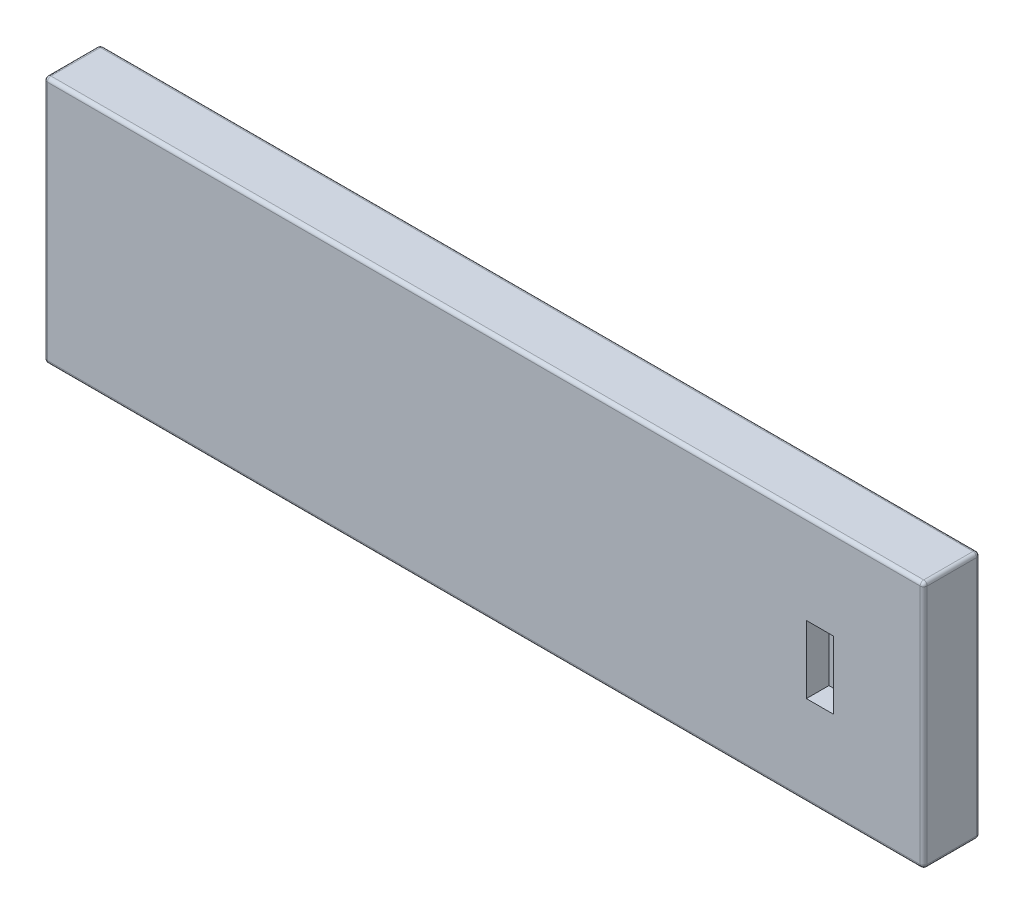
from build123d import *

# Parameters (mm, degrees)
SKETCH1_W           = 123.825
SKETCH1_H           = 34.925
BOSS_EXTRUDE1_DEPTH = 3.96875
SKETCH2_W           = 3.81
SKETCH2_H           = 9.525
CUT_EXTRUDE1_DEPTH  = 3.175
FILLET2_R           = 0.5
FILLET3_R           = 0.5
SKETCH3_W           = 0.205128206
SKETCH3_H           = 0.769230769
SKETCH3_W_2         = 2.58974359
SKETCH3_H_2         = 0.179487179
SKETCH3_W_3         = 2
SKETCH3_H_3         = 0.17948718
CUT_EXTRUDE2_DEPTH  = 1


with BuildPart() as part:
    # Sketch1 → Boss-Extrude1 (new, symmetric)
    with BuildSketch(Plane.XY):
        Rectangle(SKETCH1_W, SKETCH1_H)
    extrude(amount=BOSS_EXTRUDE1_DEPTH, both=True)

    # Sketch2 → Cut-Extrude1 (cut)
    with BuildSketch(Plane.XY.offset(3.96875)):
        with Locations((47.3075, 0)):
            Rectangle(SKETCH2_W, SKETCH2_H)
    extrude(amount=-CUT_EXTRUDE1_DEPTH, mode=Mode.SUBTRACT)

    # Fillet2
    fillet2_edges = [part.edges().sort_by_distance(p)[0] for p in [
        (-61.9125, 0, 3.96875),
        (0, -17.4625, 3.96875),
        (61.9125, 0, 3.96875),
        (61.9125, -17.4625, 0),
        (-61.9125, -17.4625, 0),
        (-61.9125, 17.4625, 0),
        (61.9125, 17.4625, 0),
        (0, 17.4625, 3.96875),
    ]]
    fillet(fillet2_edges, radius=FILLET2_R)

    # Fillet3
    fillet3_edges = [part.edges().sort_by_distance(p)[0] for p in [
        (61.9125, 0, -3.96875),
        (0, -17.4625, -3.96875),
        (-61.9125, 0, -3.96875),
        (0, 17.4625, -3.96875),
        (-61.766053391, 17.316053391, -3.96875),
        (-61.766053391, -17.316053391, -3.96875),
        (61.766053391, 17.316053391, -3.96875),
        (61.766053391, -17.316053391, -3.96875),
    ]]
    fillet(fillet3_edges, radius=FILLET3_R)

    # Sketch3 → Cut-Extrude2 (cut)
    # profile 1 of 12: a face of its own
    with BuildSketch(Plane.ZY.offset(61.9125)):
        Polygon((1.024712068, 9.333333333), (1.024712068, 8.205128205), (0.819583863, 8.205128205), (0.819583863, 9.153846154), (0.204199247, 9.153846154), (0.204199247, 8.205128205), (-0.000928958, 8.205128205), (-0.000928958, 9.153846154), (-0.770159727, 9.153846154), (-0.770159727, 8.205128205), (-0.975287932, 8.205128205), (-0.975287932, 9.333333333), align=None)
    # profile 2 of 12: a face of its own
    with BuildSketch(Plane.ZY.offset(61.9125)):
        Polygon((1.075994119, 6.933894231), (1.075994119, 6.897435897), (-0.308621266, 6.897435897), (-0.308621266, 6.666666667), (-0.513749471, 6.666666667), (-0.513749471, 6.897435897), (-0.975287932, 6.897435897), (-0.975287932, 7.076923077), (-0.513749471, 7.076923077), (-0.513749471, 8.025641026), align=None)
        Polygon((-0.308621266, 7.076923077), (0.559968478, 7.076923077), (-0.308621266, 7.673076923), align=None, mode=Mode.SUBTRACT)
    # profile 3 of 12: a face of its own
    with BuildSketch(Plane.ZY.offset(61.9125)):
        with Locations((-0.206057163, 5.333333334)):
            Rectangle(SKETCH3_W, SKETCH3_H)
    # profile 4 of 12: a face of its own
    with BuildSketch(Plane.ZY.offset(61.9125)):
        with BuildLine():
            Line((1.024712068, 2.769230769), (0.819583863, 2.769230769))
            Line((0.819583863, 2.769230769), (0.819583863, 3.449519231))
            Line((0.819583863, 3.449519231), (0.293542196, 3.557291667))
            add(Edge.make_bspline(
                [(0.293542196, 3.557291667), (0.299388066, 3.536116881), (0.310713513, 3.495094084), (0.323288239, 3.434545592), (0.330868493, 3.377064333), (0.331903528, 3.339764121), (0.332404375, 3.321714744)],
                knots=[0, 0, 0, 0, 1.100273476, 2.13160584, 3.095893838, 4, 4, 4, 4], degree=3))
            add(Edge.make_bspline(
                [(0.332404375, 3.321714744), (0.331920857, 3.299381255), (0.330970139, 3.255468037), (0.321845166, 3.191216115), (0.307472971, 3.12988701), (0.287427799, 3.071585506), (0.26162993, 3.016186028), (0.229821698, 2.963997951), (0.192223116, 2.914725508), (0.149196947, 2.869020059), (0.101784968, 2.827620389), (0.050974137, 2.791076771), (-0.003281763, 2.760684274), (-0.060742816, 2.735679911), (-0.12131261, 2.715841364), (-0.18543948, 2.702601029), (-0.25255436, 2.693794419), (-0.298442454, 2.69280979), (-0.321842419, 2.692307692)],
                knots=[0, 0, 0, 0, 1.052772836, 2.070014431, 3.053871312, 4.019926262, 4.972333346, 5.930471369, 6.896690565, 7.89035727, 8.885779078, 9.861050232, 10.836829716, 11.812751485, 12.812646763, 13.836748493, 14.896881366, 16, 16, 16, 16], degree=3))
            add(Edge.make_bspline(
                [(-0.321842419, 2.692307692), (-0.338140852, 2.692687684), (-0.370517459, 2.693442533), (-0.418599546, 2.697282476), (-0.465665188, 2.704671522), (-0.511713681, 2.714606238), (-0.55668346, 2.727449664), (-0.600558169, 2.743166409), (-0.643472907, 2.761692576), (-0.685430482, 2.782609059), (-0.725137411, 2.806805552), (-0.763206629, 2.832293734), (-0.798237109, 2.860527624), (-0.831507697, 2.890140277), (-0.861711805, 2.922315781), (-0.890141997, 2.956055461), (-0.915563323, 2.992151102), (-0.938945205, 3.029956458), (-0.959880434, 3.069447689), (-0.977344154, 3.111025229), (-0.992651256, 3.153776342), (-1.005099072, 3.198082064), (-1.014756779, 3.243856561), (-1.021333546, 3.291257461), (-1.026118716, 3.340046915), (-1.026418535, 3.373118283), (-1.026569984, 3.389823718)],
                knots=[0, 0, 0, 0, 1.05623316, 2.098192244, 3.122504159, 4.140841222, 5.148757784, 6.150489607, 7.158294732, 8.176043417, 9.185147859, 10.169157858, 11.142149047, 12.097904048, 13.0527185, 13.998867679, 14.954465986, 15.910220987, 16.877849176, 17.847023716, 18.829548819, 19.818454515, 20.826519638, 21.858115382, 22.918063636, 24, 24, 24, 24], degree=3))
            add(Edge.make_bspline(
                [(-1.026569984, 3.389823718), (-1.026175184, 3.409751797), (-1.025398464, 3.448957938), (-1.017274108, 3.50639861), (-1.005635784, 3.561662829), (-0.988135903, 3.614313228), (-0.966176101, 3.664794019), (-0.938598427, 3.712433206), (-0.906910425, 3.75816716), (-0.870018751, 3.800752886), (-0.829317633, 3.84019738), (-0.785622519, 3.876048998), (-0.73875967, 3.907490653), (-0.689128047, 3.934650655), (-0.636642251, 3.957784281), (-0.581145223, 3.975966509), (-0.522916148, 3.990639242), (-0.482828497, 3.996846996), (-0.462467419, 4)],
                knots=[0, 0, 0, 0, 1.046825758, 2.059506013, 3.044032586, 4.011925612, 4.970610144, 5.93275819, 6.900651216, 7.891265644, 8.889116719, 9.876966323, 10.858259055, 11.851035124, 12.847502422, 13.86866322, 14.9174643, 16, 16, 16, 16], degree=3))
            Line((-0.462467419, 4), (-0.462467419, 3.820512821))
            add(Edge.make_bspline(
                [(-0.462467419, 3.820512821), (-0.481541498, 3.816099281), (-0.518202935, 3.807616214), (-0.569682343, 3.78894737), (-0.615730166, 3.766261983), (-0.656389875, 3.738672926), (-0.692032442, 3.706428015), (-0.72406929, 3.6698973), (-0.752588855, 3.628560354), (-0.776514327, 3.582643529), (-0.796889133, 3.534172832), (-0.810463484, 3.483450331), (-0.820006341, 3.431847424), (-0.820961701, 3.396945555), (-0.821441778, 3.379407051)],
                knots=[0, 0, 0, 0, 1.136389429, 2.184203582, 3.172920998, 4.111012962, 5.028380909, 5.957351669, 6.927793475, 7.937618031, 8.960409703, 9.974842029, 10.982339866, 12, 12, 12, 12], degree=3))
            add(Edge.make_bspline(
                [(-0.821441778, 3.379407051), (-0.820972762, 3.36228794), (-0.820049266, 3.32858027), (-0.812941259, 3.278973764), (-0.801994076, 3.231080693), (-0.785611301, 3.185373632), (-0.765700034, 3.141052752), (-0.740148562, 3.099239169), (-0.710742837, 3.058723239), (-0.677053334, 3.020764306), (-0.639927794, 2.985998906), (-0.600226427, 2.955281123), (-0.557873943, 2.929694315), (-0.51360357, 2.908131967), (-0.466930109, 2.891758653), (-0.418072294, 2.880078093), (-0.366909448, 2.873219202), (-0.3320127, 2.87227567), (-0.31423024, 2.871794872)],
                knots=[0, 0, 0, 0, 1.027316725, 2.022795036, 3.002884548, 3.971462791, 4.93288096, 5.914575861, 6.907176829, 7.935150275, 8.956128384, 9.956726525, 10.942570165, 11.921478529, 12.907843606, 13.90538589, 14.932640048, 16, 16, 16, 16], degree=3))
            add(Edge.make_bspline(
                [(-0.31423024, 2.871794872), (-0.298177286, 2.87211054), (-0.266737907, 2.872728771), (-0.220944097, 2.879598827), (-0.177299929, 2.889222709), (-0.136195699, 2.903998953), (-0.097029495, 2.922256256), (-0.060639617, 2.945419161), (-0.026091146, 2.971896748), (0.005212401, 3.002909326), (0.034299122, 3.036727224), (0.059058406, 3.07413547), (0.079897295, 3.114280811), (0.097878355, 3.156698605), (0.110793249, 3.202392587), (0.120489132, 3.250459304), (0.126097925, 3.301417403), (0.126876145, 3.336257799), (0.12727617, 3.354166667)],
                knots=[0, 0, 0, 0, 1.045726679, 2.048034203, 3.01323695, 3.95502507, 4.889743367, 5.8246644, 6.761650845, 7.722168973, 8.692072792, 9.66525385, 10.638902184, 11.638179751, 12.663148338, 13.728659964, 14.832472288, 16, 16, 16, 16], degree=3))
            add(Edge.make_bspline(
                [(0.12727617, 3.354166667), (0.12695567, 3.369803537), (0.126299556, 3.401814638), (0.121136074, 3.451031651), (0.113192554, 3.502526279), (0.101743406, 3.556498442), (0.087408285, 3.612800022), (0.069505517, 3.671524649), (0.048883785, 3.732673742), (0.032888867, 3.773831461), (0.024712068, 3.794871795)],
                knots=[0, 0, 0, 0, 0.824638674, 1.688163388, 2.607705698, 3.571998603, 4.597075385, 5.671199175, 6.809488238, 8, 8, 8, 8], degree=3))
            Line((0.024712068, 3.794871795), (1.024712068, 3.58974359))
            Line((1.024712068, 3.58974359), (1.024712068, 2.769230769))
        make_face()
    # profile 5 of 12: a face of its own
    with BuildSketch(Plane.ZY.offset(61.9125)):
        Polygon((1.024712068, 2.062099359), (1.024712068, 1.692307692), (-0.975287932, 1.692307692), (-0.975287932, 1.871794872), (0.819583863, 1.871794872), (0.819583863, 2.179487179), align=None)
    # profile 6 of 12: a face of its own
    with BuildSketch(Plane.ZY.offset(61.9125)):
        with BuildLine():
            add(Edge.make_bspline(
                [(0.023910786, 0.948717949), (0.055966436, 0.94853051), (0.118234998, 0.948166407), (0.208969079, 0.944115881), (0.294089245, 0.937387114), (0.373599567, 0.928165757), (0.44752058, 0.916944059), (0.515654712, 0.901963764), (0.578317395, 0.884927932), (0.635712681, 0.865183491), (0.688614811, 0.842905395), (0.737998577, 0.81865499), (0.783801283, 0.791483107), (0.826711008, 0.762896272), (0.866248859, 0.731849846), (0.902339961, 0.698671292), (0.935006106, 0.663031492), (0.964636077, 0.62563532), (0.990447559, 0.586246443), (1.01370542, 0.546079089), (1.032794569, 0.504424472), (1.048479723, 0.461662496), (1.061047839, 0.417917516), (1.069751236, 0.373008782), (1.075205926, 0.326925445), (1.075728895, 0.295822117), (1.075994119, 0.280048077)],
                knots=[0, 0, 0, 0, 1.646377244, 3.198111528, 4.663803227, 6.031090796, 7.308794487, 8.502186765, 9.612154809, 10.642545331, 11.617106989, 12.558866172, 13.465886467, 14.35053239, 15.20542558, 16.045215227, 16.865619885, 17.686225247, 18.492864914, 19.282407821, 20.068097601, 20.842842034, 21.620163247, 22.403093475, 23.190129512, 24, 24, 24, 24], degree=3))
            add(Edge.make_bspline(
                [(1.075994119, 0.280048077), (1.075715368, 0.264142089), (1.075161018, 0.232510084), (1.069833051, 0.185744155), (1.060992409, 0.140058623), (1.048466138, 0.095648258), (1.032925752, 0.052148266), (1.013447399, 0.00989889), (0.990773761, -0.0313623), (0.964131545, -0.070979607), (0.934427387, -0.109387958), (0.900848719, -0.145643937), (0.863734594, -0.179750843), (0.8234821, -0.212136732), (0.779319195, -0.241882788), (0.732013989, -0.270210463), (0.680739209, -0.295565912), (0.62635037, -0.319985727), (0.567342565, -0.341064005), (0.504048416, -0.360073288), (0.43572031, -0.375432699), (0.362716741, -0.388226568), (0.284769608, -0.398137938), (0.202045999, -0.40535659), (0.11449149, -0.409169782), (0.054629862, -0.409887897), (0.023910786, -0.41025641)],
                knots=[0, 0, 0, 0, 0.810914788, 1.612654377, 2.396697861, 3.181598691, 3.963628158, 4.749916497, 5.551656086, 6.361998678, 7.18212741, 8.025565596, 8.878627764, 9.750805457, 10.657531673, 11.591944965, 12.560506719, 13.57287815, 14.630710178, 15.753379473, 16.941251878, 18.199788006, 19.531962791, 20.947069417, 22.433333509, 24, 24, 24, 24], degree=3))
            add(Edge.make_bspline(
                [(0.023910786, -0.41025641), (-0.00667419, -0.409883616), (-0.066267768, -0.409157242), (-0.153429906, -0.405404339), (-0.235708951, -0.39797707), (-0.313333938, -0.38879071), (-0.385843982, -0.375704868), (-0.453928567, -0.360828571), (-0.517000132, -0.342338932), (-0.575696734, -0.321547951), (-0.629819103, -0.297658023), (-0.680650637, -0.272078478), (-0.727917243, -0.243924684), (-0.772079507, -0.21400123), (-0.812681094, -0.181890617), (-0.84982235, -0.147639288), (-0.883478778, -0.111221172), (-0.913588788, -0.072725984), (-0.939920869, -0.03248544), (-0.963457515, 0.008638024), (-0.982556043, 0.051465198), (-0.998681301, 0.095044282), (-1.011236389, 0.139786472), (-1.019832773, 0.185647883), (-1.025878455, 0.23247832), (-1.026338676, 0.264136586), (-1.026569984, 0.280048077)],
                knots=[0, 0, 0, 0, 1.56130642, 3.042141888, 4.451772327, 5.777565838, 7.030558081, 8.211376819, 9.333164717, 10.383253789, 11.387583522, 12.350962576, 13.286244149, 14.193812918, 15.072134482, 15.925989337, 16.770211267, 17.600669898, 18.417446232, 19.22325363, 20.01647746, 20.807971184, 21.593601364, 22.38506573, 23.188331689, 24, 24, 24, 24], degree=3))
            add(Edge.make_bspline(
                [(-1.026569984, 0.280048077), (-1.026302207, 0.295821476), (-1.025774205, 0.32692354), (-1.02035638, 0.373016134), (-1.011521733, 0.417854828), (-0.999524325, 0.461529259), (-0.984276332, 0.504128806), (-0.964881449, 0.545236166), (-0.942386402, 0.585394226), (-0.916794076, 0.624419742), (-0.887465937, 0.661568912), (-0.855029887, 0.697054578), (-0.818672363, 0.729980742), (-0.778975323, 0.760638058), (-0.736275596, 0.789730186), (-0.690152559, 0.816635804), (-0.640306097, 0.840838907), (-0.587111931, 0.863616275), (-0.529294818, 0.883694481), (-0.466297918, 0.901296177), (-0.397772747, 0.915969652), (-0.323922736, 0.927770137), (-0.244692612, 0.937498449), (-0.159942873, 0.944084019), (-0.069746641, 0.948169633), (-0.007878052, 0.948531841), (0.023910786, 0.948717949)],
                knots=[0, 0, 0, 0, 0.810940842, 1.599017053, 2.38298203, 3.159479784, 3.926441347, 4.70693857, 5.494146311, 6.292334103, 7.104379492, 7.925868426, 8.762126819, 9.623561095, 10.503686106, 11.41783325, 12.366995289, 13.351843594, 14.392337808, 15.512229747, 16.713911458, 17.994391108, 19.357476964, 20.818259213, 22.365182633, 24, 24, 24, 24], degree=3))
        make_face()
        with BuildLine():
            add(Edge.make_bspline(
                [(0.024712068, 0.769230769), (-0.002001474, 0.769162514), (-0.053847214, 0.769030043), (-0.12918622, 0.765569357), (-0.19945498, 0.760854939), (-0.264742714, 0.754774196), (-0.32482844, 0.745743946), (-0.380125386, 0.735625763), (-0.430341002, 0.723312628), (-0.475819579, 0.708743853), (-0.517333921, 0.69215074), (-0.555961128, 0.67403081), (-0.592169521, 0.654575658), (-0.625591343, 0.63276437), (-0.656559285, 0.609091672), (-0.684984352, 0.583518693), (-0.71074252, 0.556090407), (-0.741307083, 0.518120669), (-0.773265088, 0.468240401), (-0.800751412, 0.405070781), (-0.8181366, 0.340132846), (-0.82034133, 0.296044381), (-0.821441778, 0.274038462)],
                knots=[0, 0, 0, 0, 1.459116078, 2.831857795, 4.118796693, 5.306371758, 6.412361096, 7.436813035, 8.376339383, 9.234574298, 10.043323891, 10.816788787, 11.564361537, 12.286735248, 12.994408768, 13.691741332, 14.372975427, 15.047457468, 16.352811911, 17.594285292, 18.799233213, 20, 20, 20, 20], degree=3))
            add(Edge.make_bspline(
                [(-0.821441778, 0.274038462), (-0.820528761, 0.251891221), (-0.818704611, 0.207642464), (-0.801105332, 0.142994582), (-0.77455131, 0.080234427), (-0.743152735, 0.031050461), (-0.713250833, -0.006368135), (-0.687756748, -0.033177844), (-0.659210538, -0.057784728), (-0.62841094, -0.081123057), (-0.594769521, -0.102528243), (-0.558448049, -0.121992893), (-0.519345662, -0.139754806), (-0.492048668, -0.149874261), (-0.478092419, -0.155048077)],
                knots=[0, 0, 0, 0, 1.353760809, 2.704726607, 4.075137775, 5.516104923, 6.260822281, 7.007110065, 7.778089737, 8.566572457, 9.372053459, 10.217411131, 11.088608312, 12, 12, 12, 12], degree=3))
            add(Edge.make_bspline(
                [(-0.478092419, -0.155048077), (-0.460246854, -0.161077659), (-0.424012703, -0.173320295), (-0.367804902, -0.189098452), (-0.308831894, -0.201524394), (-0.247446113, -0.21270346), (-0.183194855, -0.220333778), (-0.116276922, -0.226475386), (-0.046641857, -0.230092921), (0.000669566, -0.23054135), (0.024712068, -0.230769231)],
                knots=[0, 0, 0, 0, 0.884706709, 1.796334032, 2.740027952, 3.714592787, 4.726048262, 5.777819803, 6.87074269, 8, 8, 8, 8], degree=3))
            add(Edge.make_bspline(
                [(0.024712068, -0.230769231), (0.048754053, -0.230517903), (0.095791132, -0.230026191), (0.164606422, -0.226795597), (0.230080332, -0.221604303), (0.292272257, -0.214577999), (0.351071503, -0.20493237), (0.406562212, -0.193348929), (0.458729422, -0.179768675), (0.50770767, -0.164191717), (0.553320913, -0.146636702), (0.595668462, -0.127243674), (0.634974817, -0.106548686), (0.671127155, -0.084066613), (0.704288659, -0.06006928), (0.733794128, -0.033922058), (0.760558113, -0.006662429), (0.791108152, 0.031518824), (0.822257693, 0.08150413), (0.850923841, 0.143701644), (0.867385723, 0.208427726), (0.869706687, 0.252183986), (0.870865914, 0.274038462)],
                knots=[0, 0, 0, 0, 1.313668642, 2.570134578, 3.763346207, 4.902004944, 5.98888779, 7.017888835, 7.998425394, 8.933058446, 9.82474457, 10.667209444, 11.476765193, 12.250262638, 12.991704352, 13.7104269, 14.401925311, 15.076585796, 16.378385137, 17.609787933, 18.806186071, 20, 20, 20, 20], degree=3))
            add(Edge.make_bspline(
                [(0.870865914, 0.274038462), (0.869706583, 0.296159729), (0.867385809, 0.340442563), (0.850967008, 0.405827324), (0.822524581, 0.468467899), (0.790906999, 0.518052178), (0.761098935, 0.556185259), (0.73517773, 0.583112537), (0.706666672, 0.608286739), (0.675829841, 0.631979159), (0.642391163, 0.65376945), (0.606188035, 0.673232564), (0.567557239, 0.691342093), (0.526052341, 0.707970831), (0.480505203, 0.72240459), (0.43054302, 0.735305709), (0.375194425, 0.745417753), (0.314940715, 0.75424195), (0.249572722, 0.760969901), (0.17914196, 0.765557255), (0.103672668, 0.769036305), (0.051559426, 0.76916465), (0.024712068, 0.769230769)],
                knots=[0, 0, 0, 0, 1.207964612, 2.418129846, 3.655795183, 4.951004962, 5.620895151, 6.296795572, 6.989224116, 7.696855977, 8.419187164, 9.166715907, 9.940135271, 10.748837255, 11.607021648, 12.548275234, 13.5654991, 14.678641405, 15.874140913, 17.15372626, 18.533675393, 20, 20, 20, 20], degree=3))
        make_face(mode=Mode.SUBTRACT)
    # profile 7 of 12: a face of its own
    with BuildSketch(Plane.ZY.offset(61.9125)):
        with Locations((-0.218877676, -2.192307693)):
            Rectangle(SKETCH3_W_2, SKETCH3_H_2)
    # profile 8 of 12: a face of its own
    with BuildSketch(Plane.ZY.offset(61.9125)):
        with BuildLine():
            Line((1.024712068, -4.820512821), (1.024712068, -5))
            Line((1.024712068, -5), (-0.32584883, -5))
            add(Edge.make_bspline(
                [(-0.32584883, -5), (-0.350823408, -4.999822127), (-0.398777646, -4.99948059), (-0.467845874, -4.997566764), (-0.530923403, -4.99412817), (-0.588089355, -4.988810649), (-0.639333584, -4.982684243), (-0.684826544, -4.974736605), (-0.724342302, -4.965339194), (-0.768692478, -4.951103708), (-0.817493156, -4.92789131), (-0.869776275, -4.892301138), (-0.915883214, -4.848820782), (-0.955774162, -4.798326393), (-0.987585182, -4.740541665), (-1.010414791, -4.676596995), (-1.024341534, -4.606902596), (-1.02581226, -4.558560077), (-1.026569984, -4.533653846)],
                knots=[0, 0, 0, 0, 1.237549021, 2.376245131, 3.423509879, 4.367128923, 5.220764738, 5.980167839, 6.654279555, 7.23186528, 8.285695362, 9.319068926, 10.353713031, 11.414109097, 12.495220016, 13.606748513, 14.766988686, 16, 16, 16, 16], degree=3))
            add(Edge.make_bspline(
                [(-1.026569984, -4.533653846), (-1.025972389, -4.514112284), (-1.024778151, -4.475060261), (-1.014454048, -4.416860767), (-0.999145212, -4.358961941), (-0.975996462, -4.300977898), (-0.945045636, -4.24168225), (-0.904343676, -4.180220271), (-0.85416191, -4.115861366), (-0.81585349, -4.073471331), (-0.795800753, -4.051282051)],
                knots=[0, 0, 0, 0, 0.854372818, 1.707385869, 2.579105618, 3.471016644, 4.432770875, 5.500780854, 6.691771033, 8, 8, 8, 8], degree=3))
            Line((-0.795800753, -4.051282051), (-0.641954599, -4.157051282))
            add(Edge.make_bspline(
                [(-0.641954599, -4.157051282), (-0.658750406, -4.181471637), (-0.690398599, -4.227486699), (-0.731668991, -4.294966798), (-0.766358975, -4.355170199), (-0.784307734, -4.394499733), (-0.792595625, -4.412660256)],
                knots=[0, 0, 0, 0, 1.196704426, 2.25493972, 3.19421351, 4, 4, 4, 4], degree=3))
            add(Edge.make_bspline(
                [(-0.792595625, -4.412660256), (-0.796915314, -4.423679863), (-0.805387188, -4.445291765), (-0.814841987, -4.478334668), (-0.820009079, -4.511188975), (-0.820969841, -4.532970514), (-0.821441778, -4.543669872)],
                knots=[0, 0, 0, 0, 1.051806502, 2.062826769, 3.048436908, 4, 4, 4, 4], degree=3))
            add(Edge.make_bspline(
                [(-0.821441778, -4.543669872), (-0.820875719, -4.557493727), (-0.819762149, -4.58468846), (-0.809338756, -4.624307119), (-0.794056772, -4.662389674), (-0.771125243, -4.69736661), (-0.744035836, -4.729524782), (-0.711273741, -4.756106718), (-0.674841199, -4.778085484), (-0.640629957, -4.791975533), (-0.609185698, -4.800352467), (-0.580413384, -4.805900948), (-0.546642682, -4.809916429), (-0.508086242, -4.814242785), (-0.464479497, -4.816573272), (-0.416023141, -4.819291433), (-0.362577663, -4.820259016), (-0.325314403, -4.820425638), (-0.305816778, -4.820512821)],
                knots=[0, 0, 0, 0, 0.99710849, 1.961544003, 2.943780681, 3.950512064, 4.9701611, 5.971139155, 6.984143068, 8.036211364, 8.626223178, 9.334153146, 10.151809154, 11.083375733, 12.13756692, 13.306844995, 14.590833851, 16, 16, 16, 16], degree=3))
            Line((-0.305816778, -4.820512821), (1.024712068, -4.820512821))
        make_face()
    # profile 9 of 12: a face of its own
    with BuildSketch(Plane.ZY.offset(61.9125)):
        with BuildLine():
            Line((0.657724888, -7.358974359), (0.537532581, -7.201923077))
            add(Edge.make_bspline(
                [(0.537532581, -7.201923077), (0.550884563, -7.190719712), (0.577408515, -7.168464028), (0.614653969, -7.13265877), (0.649548404, -7.095343545), (0.68225805, -7.056532619), (0.711639059, -7.015527408), (0.739222546, -6.973321237), (0.763946968, -6.929208068), (0.793925817, -6.868207077), (0.825209334, -6.788408307), (0.851439752, -6.687954113), (0.868137567, -6.583090628), (0.869946048, -6.511549142), (0.870865914, -6.475160256)],
                knots=[0, 0, 0, 0, 0.757959112, 1.505699292, 2.245454638, 2.979532153, 3.711538275, 4.438200793, 5.171680507, 5.909471876, 7.393775596, 8.890124382, 10.418191784, 12, 12, 12, 12], degree=3))
            add(Edge.make_bspline(
                [(0.870865914, -6.475160256), (0.870634037, -6.4551129), (0.870172434, -6.415204247), (0.864125448, -6.355972952), (0.855528456, -6.297735504), (0.843082525, -6.240708469), (0.826879052, -6.185005076), (0.807876703, -6.130201191), (0.784230208, -6.076942256), (0.758115812, -6.024587314), (0.728611343, -5.97443008), (0.696439763, -5.926962665), (0.661916833, -5.882401923), (0.625131664, -5.840624376), (0.585627093, -5.802088206), (0.543867844, -5.766175812), (0.499351292, -5.73353442), (0.452912307, -5.703361926), (0.404482633, -5.676513802), (0.354366934, -5.653329147), (0.302756819, -5.633457971), (0.249546563, -5.617588627), (0.19494556, -5.605071485), (0.138837935, -5.596424074), (0.081332595, -5.590431486), (0.042355897, -5.58997413), (0.022708863, -5.58974359)],
                knots=[0, 0, 0, 0, 1.055000685, 2.100209969, 3.131349012, 4.153242145, 5.170189196, 6.184191144, 7.204341339, 8.235672124, 9.263040994, 10.265373269, 11.252624173, 12.22887325, 13.193405896, 14.155809299, 15.126090485, 16.097288279, 17.069732292, 18.038585918, 19.002221264, 19.978698174, 20.959418239, 21.948869816, 22.966084182, 24, 24, 24, 24], degree=3))
            add(Edge.make_bspline(
                [(0.022708863, -5.58974359), (-0.006851892, -5.590464629), (-0.064890512, -5.591880294), (-0.149902289, -5.604479343), (-0.231342674, -5.623625109), (-0.308702584, -5.652319724), (-0.382935931, -5.687702039), (-0.452786705, -5.73241096), (-0.519310456, -5.784191838), (-0.580934997, -5.843777221), (-0.637228555, -5.909151973), (-0.686800316, -5.979293637), (-0.728123106, -6.054027515), (-0.762509361, -6.132528447), (-0.788941777, -6.215400512), (-0.807549847, -6.302494685), (-0.819688236, -6.393621539), (-0.820850343, -6.455889768), (-0.821441778, -6.487580128)],
                knots=[0, 0, 0, 0, 1.029171465, 2.020641659, 2.987623507, 3.938342917, 4.889210282, 5.84687017, 6.821220943, 7.821438502, 8.827599549, 9.822697543, 10.807740252, 11.797342354, 12.80366471, 13.83203677, 14.896651826, 16, 16, 16, 16], degree=3))
            add(Edge.make_bspline(
                [(-0.821441778, -6.487580128), (-0.820476761, -6.52249595), (-0.818577377, -6.591218641), (-0.802486378, -6.692000371), (-0.776396139, -6.788477951), (-0.73988304, -6.880656572), (-0.692417162, -6.96827637), (-0.634875517, -7.051474461), (-0.566710756, -7.130321073), (-0.514663254, -7.177733234), (-0.488108445, -7.201923077)],
                knots=[0, 0, 0, 0, 1.028121516, 2.023589091, 2.998037872, 3.967518031, 4.937445131, 5.927275754, 6.942489185, 8, 8, 8, 8], degree=3))
            Line((-0.488108445, -7.201923077), (-0.60709883, -7.358974359))
            add(Edge.make_bspline(
                [(-0.60709883, -7.358974359), (-0.623406544, -7.346335456), (-0.655943861, -7.321118189), (-0.701812996, -7.280284788), (-0.744959703, -7.237270119), (-0.785026883, -7.191749112), (-0.82285098, -7.144266198), (-0.857163971, -7.09398499), (-0.889011084, -7.041773942), (-0.91778619, -6.987329074), (-0.94358623, -6.930829134), (-0.965367337, -6.872332922), (-0.984399961, -6.812336021), (-0.999954372, -6.750808216), (-1.012114211, -6.687543959), (-1.020238385, -6.622760312), (-1.025805559, -6.556320523), (-1.02631289, -6.511496835), (-1.026569984, -6.488782051)],
                knots=[0, 0, 0, 0, 0.986756325, 1.968786143, 2.935506311, 3.899499537, 4.868307269, 5.8376204, 6.809456583, 7.792545619, 8.781780509, 9.778496008, 10.776623214, 11.79151764, 12.812666265, 13.856269958, 14.913646641, 16, 16, 16, 16], degree=3))
            add(Edge.make_bspline(
                [(-1.026569984, -6.488782051), (-1.026420273, -6.467271384), (-1.02612424, -6.424736704), (-1.021328716, -6.361937418), (-1.014786009, -6.300800514), (-1.004934506, -6.241500728), (-0.993309169, -6.183714457), (-0.977725594, -6.127965551), (-0.960268927, -6.073705431), (-0.939751792, -6.021152094), (-0.916599687, -5.970260837), (-0.890433082, -5.921195801), (-0.861472017, -5.873979554), (-0.830354868, -5.828147885), (-0.796082124, -5.784377837), (-0.759129761, -5.742290109), (-0.719622327, -5.701648694), (-0.691133839, -5.676504302), (-0.676810368, -5.663862179)],
                knots=[0, 0, 0, 0, 1.114604814, 2.203992996, 3.262667896, 4.300477797, 5.318619304, 6.316056647, 7.298880507, 8.271930387, 9.238335007, 10.195173496, 11.151986948, 12.108099108, 13.064862484, 14.031167946, 15.010108607, 16, 16, 16, 16], degree=3))
            add(Edge.make_bspline(
                [(-0.676810368, -5.663862179), (-0.651929689, -5.64361324), (-0.602468711, -5.603359825), (-0.522305294, -5.551859434), (-0.438609174, -5.507775117), (-0.350940643, -5.472131734), (-0.259496422, -5.444267315), (-0.164230414, -5.424963775), (-0.06523159, -5.412420001), (0.002103718, -5.41098555), (0.036330657, -5.41025641)],
                knots=[0, 0, 0, 0, 0.994628077, 1.977248131, 2.950237994, 3.925870899, 4.908910175, 5.911660606, 6.938484602, 8, 8, 8, 8], degree=3))
            add(Edge.make_bspline(
                [(0.036330657, -5.41025641), (0.072303697, -5.411149067), (0.143078407, -5.412905314), (0.24697072, -5.427703323), (0.346363672, -5.45179734), (0.441639706, -5.484974962), (0.532253688, -5.528745116), (0.618588318, -5.581732427), (0.700573102, -5.644454453), (0.777159857, -5.716123466), (0.847180479, -5.794737514), (0.908784512, -5.87891861), (0.960051535, -5.96850858), (1.00290652, -6.062518704), (1.035846203, -6.1616534), (1.05890517, -6.265701034), (1.073257807, -6.37446613), (1.075072212, -6.44867323), (1.075994119, -6.486378205)],
                knots=[0, 0, 0, 0, 1.032901378, 2.032168977, 3.007206631, 3.966850309, 4.924221947, 5.891988639, 6.871730993, 7.884084801, 8.900290346, 9.89161143, 10.874607481, 11.860025555, 12.854717796, 13.869097222, 14.917278314, 16, 16, 16, 16], degree=3))
            add(Edge.make_bspline(
                [(1.075994119, -6.486378205), (1.075718817, -6.509357948), (1.075173885, -6.554844036), (1.069853106, -6.622130613), (1.06099916, -6.687642914), (1.048868655, -6.75153937), (1.034000722, -6.814051684), (1.01453745, -6.874538525), (0.991935819, -6.933329267), (0.96656873, -6.990467942), (0.937568336, -7.045332898), (0.906070867, -7.09791415), (0.871349258, -7.147577401), (0.834551405, -7.195256821), (0.794300828, -7.239878995), (0.751908318, -7.282718321), (0.706115939, -7.322294967), (0.673884766, -7.346725514), (0.657724888, -7.358974359)],
                knots=[0, 0, 0, 0, 1.096705196, 2.170817488, 3.219277236, 4.250701065, 5.274195539, 6.284202015, 7.28098643, 8.279664616, 9.266225751, 10.241373748, 11.203306326, 12.157093976, 13.114198862, 14.069774147, 15.032234603, 16, 16, 16, 16], degree=3))
        make_face()
    # profile 10 of 12: a face of its own
    with BuildSketch(Plane.ZY.offset(61.9125)):
        with Locations((0.024712068, -7.858974359)):
            Rectangle(SKETCH3_W_3, SKETCH3_H_3)
    # profile 11 of 12: a face of its own
    with BuildSketch(Plane.ZY.offset(61.9125)):
        with Locations((0.024712068, -8.474358974)):
            Rectangle(SKETCH3_W_3, SKETCH3_H_2)
    # profile 12 of 12: a face of its own
    with BuildSketch(Plane.ZY.offset(61.9125)):
        with Locations((0.024712068, -9.089743589)):
            Rectangle(SKETCH3_W_3, SKETCH3_H_2)
    extrude(amount=-CUT_EXTRUDE2_DEPTH, mode=Mode.SUBTRACT)


solid = part.part
